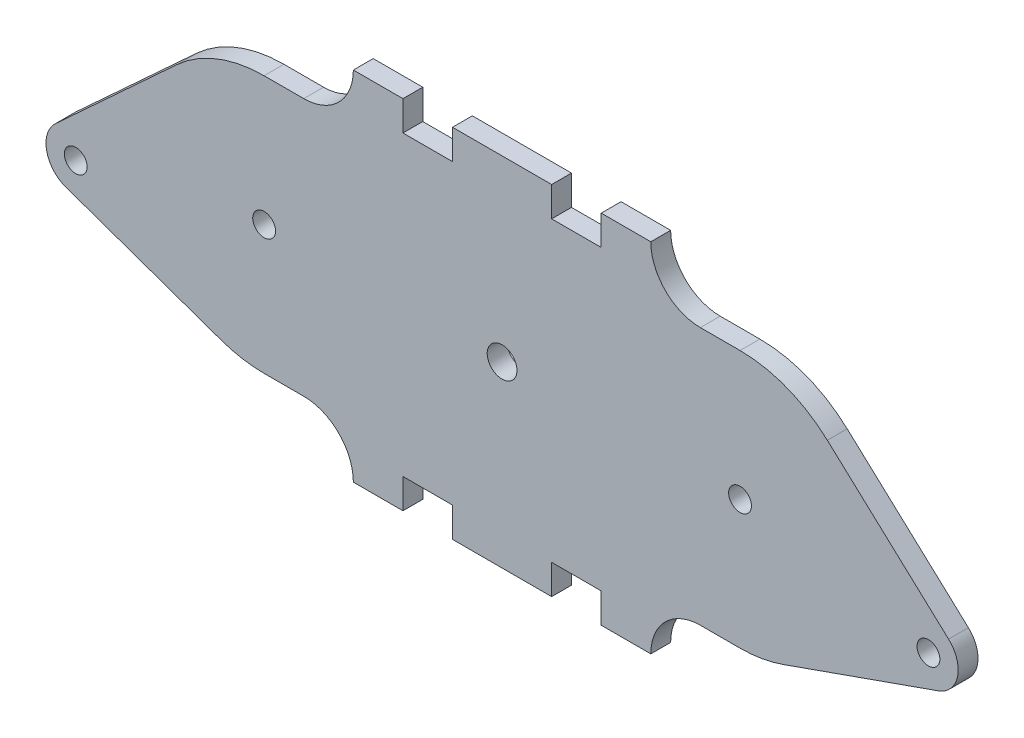
from build123d import *

# Parameters (mm, degrees)
MODEL_R         = 1.15
MODEL_R_2       = 1.5
EXTRUDE_1_DEPTH = 2


with BuildPart() as part:
    # Model → Бобышка-Вытянуть1 (new body)
    # profile 1 of 3: a face of its own
    with BuildSketch(Plane.XY):
        with BuildLine():
            ThreePointArc((-11, 0), (-14.807611845, 9.192388155), (-24, 13))
            ThreePointArc((-24, 13), (-28.725958264, 12.110545755), (-32.805220584, 9.563895152))
            ThreePointArc((-32.805220584, 9.563895152), (-36.734496712, -2.613923009), (-28.325743505, -12.259198307))
            ThreePointArc((-28.325743505, -12.259198307), (-26.194358905, -12.813461242), (-24, -13))
            ThreePointArc((-24, -13), (-14.807611845, -9.192388155), (-11, 0))
        make_face()
        with Locations((-24, 0)):
            Circle(MODEL_R, mode=Mode.SUBTRACT)
    # profile 2 of 3: a face of its own
    with BuildSketch(Plane.XY):
        with BuildLine():
            ThreePointArc((-28.325743505, -12.259198307), (-36.734496712, -2.613923009), (-32.805220584, 9.563895152))
            Line((-32.805220584, 9.563895152), (-45.031973981, -1.692947273))
            ThreePointArc((-45.031973981, -1.692947273), (-45.93873001, -4.503213002), (-43.998248501, -6.729045763))
            Line((-43.998248501, -6.729045763), (-28.325743505, -12.259198307))
        make_face()
        with Locations((-43, -3.9)):
            Circle(MODEL_R, mode=Mode.SUBTRACT)
    # profile 3 of 3: a face of its own
    with BuildSketch(Plane.XY):
        with BuildLine():
            Line((-10, 18), (-15, 18))
            ThreePointArc((-15, 18), (-16.464466094, 14.464466094), (-20, 13))
            Line((-20, 13), (-24, 13))
            ThreePointArc((-24, 13), (-14.807611845, 9.192388155), (-11, 0))
            ThreePointArc((-11, 0), (-14.807611845, -9.192388155), (-24, -13))
            Line((-24, -13), (-20, -13))
            ThreePointArc((-20, -13), (-16.464466094, -14.464466094), (-15, -18))
            Line((-15, -18), (-10, -18))
            Line((-10, -18), (-10, -15))
            Line((-10, -15), (-5, -15))
            Line((-5, -15), (-5, -18))
            Line((-5, -18), (5, -18))
            Line((5, -18), (5, -15))
            Line((5, -15), (10, -15))
            Line((10, -15), (10, -18))
            Line((10, -18), (15, -18))
            ThreePointArc((15, -18), (16.464466094, -14.464466094), (20, -13))
            Line((20, -13), (24, -13))
            ThreePointArc((24, -13), (26.194358905, -12.813461242), (28.325743505, -12.259198307))
            Line((28.325743505, -12.259198307), (43.998248501, -6.729045763))
            ThreePointArc((43.998248501, -6.729045763), (45.93873001, -4.503213002), (45.031973981, -1.692947273))
            Line((45.031973981, -1.692947273), (32.805220584, 9.563895152))
            ThreePointArc((32.805220584, 9.563895152), (28.725958264, 12.110545755), (24, 13))
            Line((24, 13), (20, 13))
            ThreePointArc((20, 13), (16.464466094, 14.464466094), (15, 18))
            Line((15, 18), (10, 18))
            Line((10, 18), (10, 15))
            Line((10, 15), (5, 15))
            Line((5, 15), (5, 18))
            Line((5, 18), (-5, 18))
            Line((-5, 18), (-5, 15))
            Line((-5, 15), (-10, 15))
            Line((-10, 15), (-10, 18))
        make_face()
        with Locations((43, -3.9)):
            Circle(MODEL_R, mode=Mode.SUBTRACT)
        Circle(MODEL_R_2, mode=Mode.SUBTRACT)
        with Locations((24, 0)):
            Circle(MODEL_R, mode=Mode.SUBTRACT)
    extrude(amount=EXTRUDE_1_DEPTH)


solid = part.part
